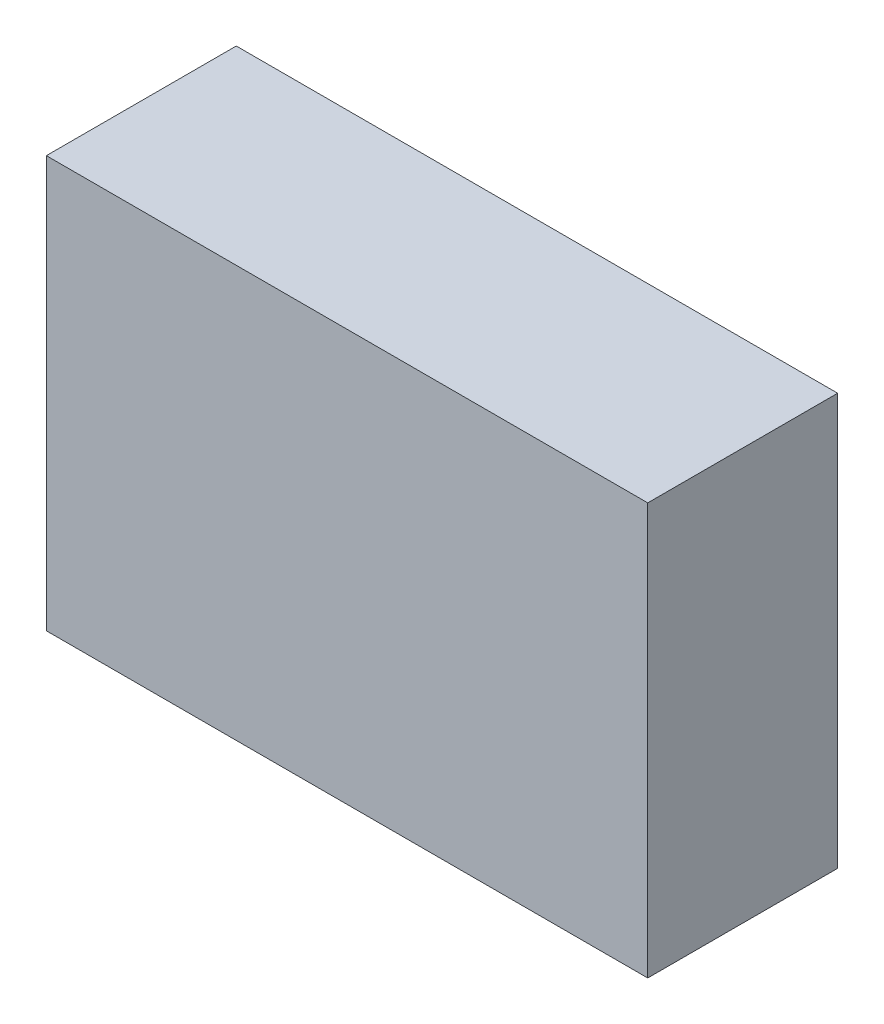
from build123d import *

# Parameters (mm, degrees)
SKETCH1_W           = 950
SKETCH1_H           = 650
BOSS_EXTRUDE1_DEPTH = 300
SHELL1_T            = 10


with BuildPart() as part:
    # Sketch1 → Boss-Extrude1 (new body)
    with BuildSketch(Plane.XY):
        with Locations((475, 325)):
            Rectangle(SKETCH1_W, SKETCH1_H)
    extrude(amount=BOSS_EXTRUDE1_DEPTH)

    # Shell1 (no face opened: a closed hollow body)
    add(offset(amount=-SHELL1_T, mode=Mode.PRIVATE), mode=Mode.SUBTRACT)


solid = part.part
